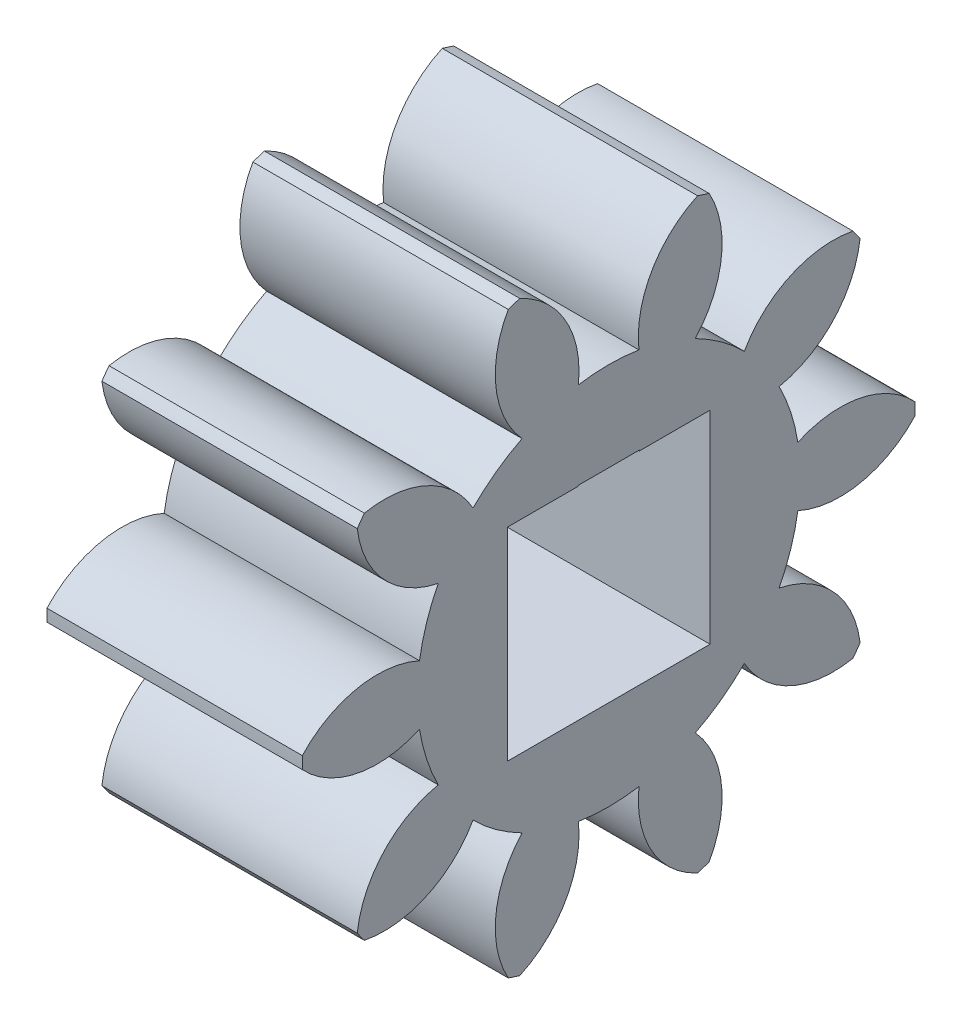
from build123d import *

# Parameters (mm, degrees)
BASPROSKE_W        = 5
BASPROSKE_H        = 6
TOOTHCUT_DEPTH     = 10.848857802
TEETHCUTS_COUNT    = 10
TEETHCUTS_ANGLE    = 324
BORSKE_R           = 1.5
BORE_DEPTH         = 50.0000508
KEYSKE_W           = 1.2
KEYSKE_H           = 2
KEYWAY_DEPTH       = 50.0000508
SKETCH1_W          = 3.96875
SKETCH1_H          = 3.96875
CUT_EXTRUDE1_DEPTH = 10.693816982


with BuildPart() as part:
    # BasProSke → Base-Revolve (revolve)
    with BuildSketch(Plane(origin=(0, 0, 0), x_dir=(1, 0, 0), z_dir=(0, 1, 0)), mode=Mode.PRIVATE) as base_revolve_sk:
        with Locations((2.5, 3)):
            Rectangle(BASPROSKE_W, BASPROSKE_H)
    revolve(base_revolve_sk.sketch.rotate(Axis((-10, 0, 0), (1, 0, 0)), 180), axis=Axis((-10, 0, 0), (1, 0, 0)))

    # TooCutSke → ToothCut (cut, through all)
    with BuildSketch(Plane(origin=(0, 0, 0), x_dir=(0, 0, -1), z_dir=(1, 0, 0))):
        with BuildLine():
            ThreePointArc((0.59278292, 3.701838653), (0, 3.749), (-0.59278292, 3.701838653))
            ThreePointArc((-0.59278292, 3.701838653), (-0.846593509, 4.924114224), (-1.775771316, 5.757784417))
            ThreePointArc((-1.775771316, 5.757784417), (0, 6.0254), (1.775771316, 5.757784417))
            ThreePointArc((1.775771316, 5.757784417), (0.846593509, 4.924114224), (0.59278292, 3.701838653))
        make_face()
    toothcut = extrude(amount=TOOTHCUT_DEPTH, mode=Mode.SUBTRACT)

    # TeethCuts: ToothCut ×10 about axis
    teethcuts_axis = Axis((-10, 0, 0), (1, 0, 0))
    for i in range(1, TEETHCUTS_COUNT):
        add(toothcut.rotate(teethcuts_axis, i * TEETHCUTS_ANGLE / (TEETHCUTS_COUNT - 1)), mode=Mode.SUBTRACT)

    # BorSke → Bore (cut, symmetric)
    with BuildSketch(Plane(origin=(0, 0, 0), x_dir=(0, 0, -1), z_dir=(1, 0, 0))):
        with Locations(Location((0, 0, 0), (0, 0, 180))):
            Circle(BORSKE_R)
    extrude(amount=BORE_DEPTH, both=True, mode=Mode.SUBTRACT)

    # KeySke → Keyway (cut, symmetric)
    with BuildSketch(Plane(origin=(0, 0, 0), x_dir=(0, 0, -1), z_dir=(1, 0, 0))):
        with Locations((0, 1)):
            Rectangle(KEYSKE_W, KEYSKE_H)
    extrude(amount=KEYWAY_DEPTH, both=True, mode=Mode.SUBTRACT)

    # Sketch1 → Cut-Extrude1 (cut, through all)
    with BuildSketch(Plane.ZY):
        Rectangle(SKETCH1_W, SKETCH1_H)
    extrude(amount=-CUT_EXTRUDE1_DEPTH, mode=Mode.SUBTRACT)


solid = part.part
